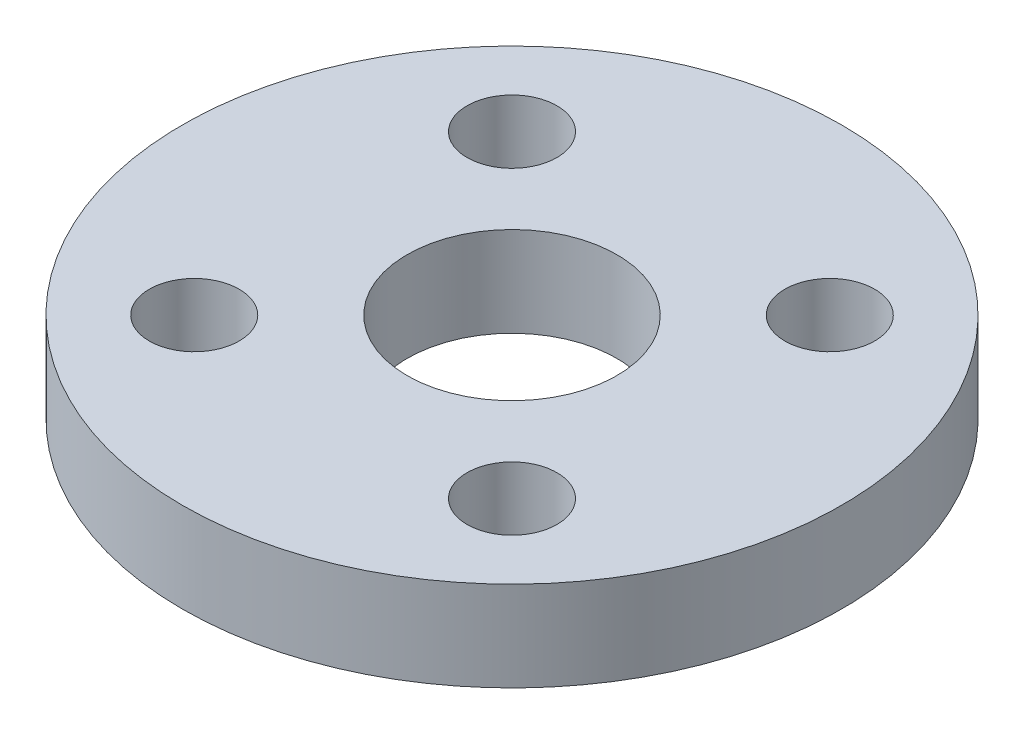
from build123d import *

# Parameters (mm, degrees)
SKETCH1_R           = 11
SKETCH1_R_2         = 1.5
BOSS_EXTRUDE1_DEPTH = 3
SKETCH2_R           = 3.5
CUT_EXTRUDE1_DEPTH  = 10


with BuildPart() as part:
    # Sketch1 → Boss-Extrude1 (new body)
    with BuildSketch(Plane(origin=(0, 0, 0), x_dir=(1, 0, 0), z_dir=(0, 1, 0))):
        with Locations(Location((0, 0, 0), (0, 0, 270))):
            Circle(SKETCH1_R)
        with Locations(Location((-5.303300859, -5.303300859, 0), (0, 0, 270))):
            Circle(SKETCH1_R_2, mode=Mode.SUBTRACT)
        with Locations(Location((-5.303300859, 5.303300859, 0), (0, 0, 270))):
            Circle(SKETCH1_R_2, mode=Mode.SUBTRACT)
        with Locations(Location((5.303300859, 5.303300859, 0), (0, 0, 270))):
            Circle(SKETCH1_R_2, mode=Mode.SUBTRACT)
        with Locations(Location((5.303300859, -5.303300859, 0), (0, 0, 270))):
            Circle(SKETCH1_R_2, mode=Mode.SUBTRACT)
    extrude(amount=BOSS_EXTRUDE1_DEPTH)

    # Sketch2 → Cut-Extrude1 (cut)
    with BuildSketch(Plane(origin=(0, 3, 0), x_dir=(1, 0, 0), z_dir=(0, 1, 0))):
        with Locations(Location((0, 0, 0), (0, 0, 270))):
            Circle(SKETCH2_R)
    extrude(amount=-CUT_EXTRUDE1_DEPTH, mode=Mode.SUBTRACT)


solid = part.part
